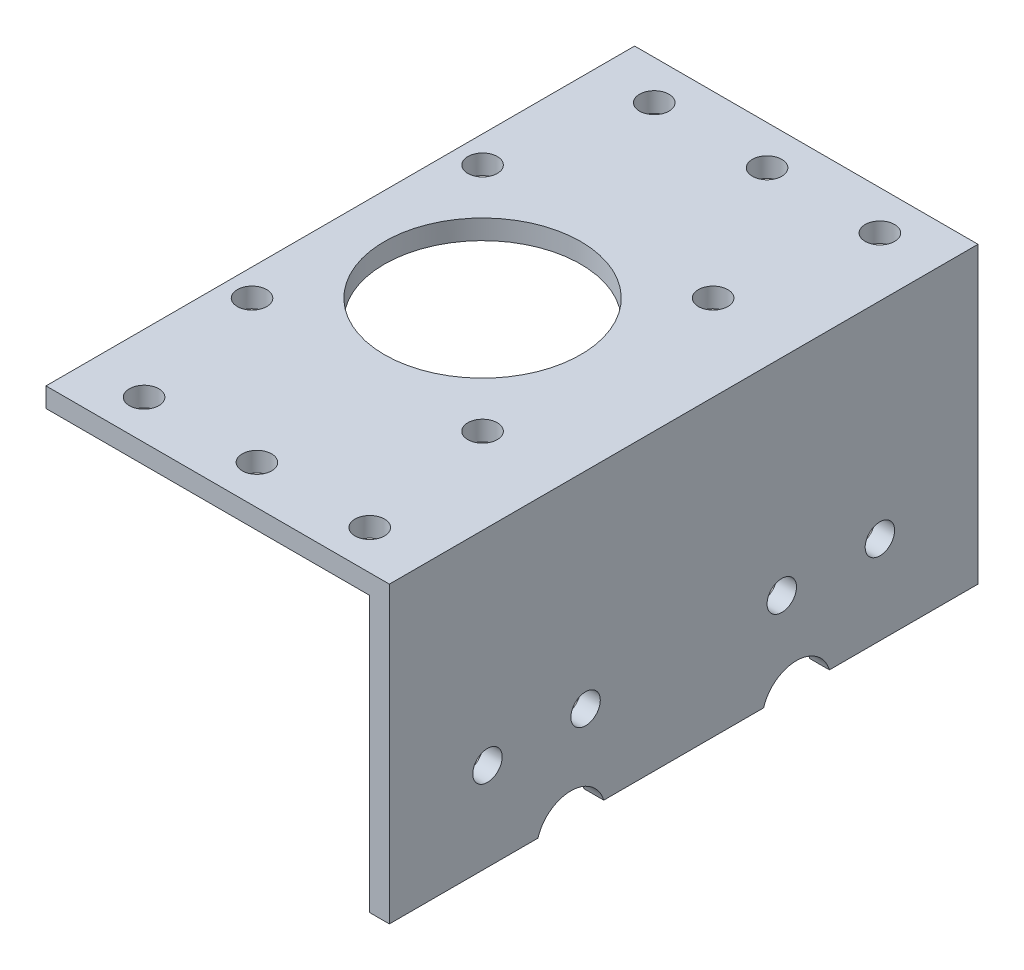
from build123d import *

# Parameters (mm, degrees)
AUFSATZ_LINEAR_AUSTRAGEN1_DEPTH = 60
SKIZZE2_R                       = 20
SKIZZE2_R_2                     = 3
SCHNITT_LINEAR_AUSTRAGEN1_DEPTH = 20
SKIZZE3_R                       = 3
SCHNITT_LINEAR_AUSTRAGEN2_DEPTH = 20
SKIZZE4_R                       = 7
SCHNITT_LINEAR_AUSTRAGEN3_DEPTH = 10
SKIZZE5_R                       = 3
SCHNITT_LINEAR_AUSTRAGEN4_DEPTH = 10


with BuildPart() as part:
    # Skizze1 → Aufsatz-Linear austragen1 (new, symmetric)
    with BuildSketch(Plane.XY):
        Polygon((-70, 0), (0, 0), (0, -60), (-4, -60), (-4, -4), (-70, -4), align=None)
    extrude(amount=AUFSATZ_LINEAR_AUSTRAGEN1_DEPTH, both=True)

    # Skizze2 → Schnitt-Linear austragen1 (cut)
    with BuildSketch(Plane(origin=(0, 0, 0), x_dir=(1, 0, 0), z_dir=(0, 1, 0))):
        with Locations((-41, 0)):
            Circle(SKIZZE2_R)
        with Locations((-17.5, 23.5)):
            Circle(SKIZZE2_R_2)
        with Locations((-64.5, 23.5)):
            Circle(SKIZZE2_R_2)
        with Locations((-17.5, -23.5)):
            Circle(SKIZZE2_R_2)
        with Locations((-64.5, -23.5)):
            Circle(SKIZZE2_R_2)
    extrude(amount=-SCHNITT_LINEAR_AUSTRAGEN1_DEPTH, mode=Mode.SUBTRACT)

    # Skizze3 → Schnitt-Linear austragen2 (cut)
    with BuildSketch(Plane(origin=(0, 0, 0), x_dir=(0, 0, -1), z_dir=(1, 0, 0))):
        with Locations((40, -42)):
            Circle(SKIZZE3_R)
        with Locations((-40, -42)):
            Circle(SKIZZE3_R)
        with Locations((20, -42)):
            Circle(SKIZZE3_R)
        with Locations((-20, -42)):
            Circle(SKIZZE3_R)
    extrude(amount=-SCHNITT_LINEAR_AUSTRAGEN2_DEPTH, mode=Mode.SUBTRACT)

    # Skizze4 → Schnitt-Linear austragen3 (cut)
    with BuildSketch(Plane(origin=(0, 0, 0), x_dir=(0, 0, -1), z_dir=(1, 0, 0))):
        with Locations((23, -62)):
            Circle(SKIZZE4_R)
        with Locations((-23, -62)):
            Circle(SKIZZE4_R)
    extrude(amount=-SCHNITT_LINEAR_AUSTRAGEN3_DEPTH, mode=Mode.SUBTRACT)

    # Skizze5 → Schnitt-Linear austragen4 (cut)
    with BuildSketch(Plane(origin=(0, 0, 0), x_dir=(1, 0, 0), z_dir=(0, 1, 0))):
        with Locations((-58, -52)):
            Circle(SKIZZE5_R)
        with Locations((-35, -52)):
            Circle(SKIZZE5_R)
        with Locations((-12, -52)):
            Circle(SKIZZE5_R)
        with Locations((-58, 52)):
            Circle(SKIZZE5_R)
        with Locations((-35, 52)):
            Circle(SKIZZE5_R)
        with Locations((-12, 52)):
            Circle(SKIZZE5_R)
    extrude(amount=-SCHNITT_LINEAR_AUSTRAGEN4_DEPTH, mode=Mode.SUBTRACT)


solid = part.part
